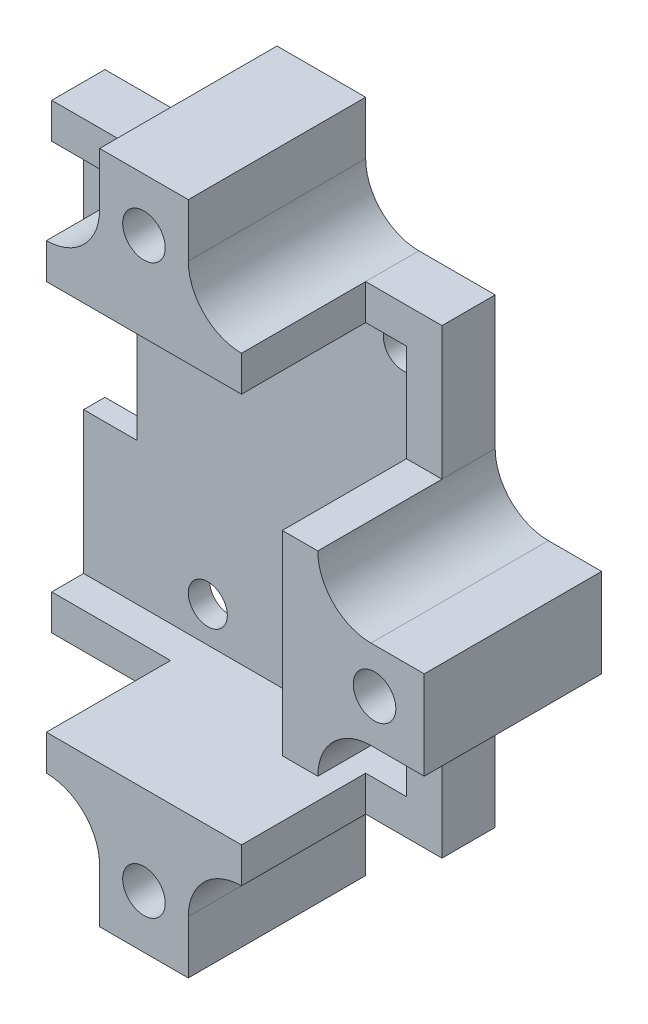
from build123d import *

# Parameters (mm, degrees)
SKETCH1_R           = 1.1
SKETCH1_W           = 5
SKETCH1_H           = 6
SKETCH1_R_2         = 1.2
SKETCH1_W_2         = 6
SKETCH1_H_2         = 5
BOSS_EXTRUDE1_DEPTH = 10
FILLET1_R           = 3
SKETCH2_W           = 28
SKETCH2_H           = 22
CUT_EXTRUDE1_DEPTH  = 8.8
SKETCH3_W           = 6.7
SKETCH3_H           = 26
SKETCH3_W_2         = 4.3
SKETCH3_H_2         = 7.5
CUT_EXTRUDE2_DEPTH  = 7


with BuildPart() as part:
    # Sketch1 → Boss-Extrude1 (new body)
    # profile 1 of 4: a face of its own
    with BuildSketch(Plane.XY):
        Polygon((0, 0), (22, 0), (22, -26), (0, -26), (0, -16), (3, -16), (3, -10), (0, -10), align=None)
        with Locations((18, -4)):
            Circle(SKETCH1_R, mode=Mode.SUBTRACT)
        with Locations((7, -4)):
            Circle(SKETCH1_R, mode=Mode.SUBTRACT)
        with Locations((7, -22)):
            Circle(SKETCH1_R, mode=Mode.SUBTRACT)
        with Locations((18, -22)):
            Circle(SKETCH1_R, mode=Mode.SUBTRACT)
    # profile 2 of 4: a face of its own
    with BuildSketch(Plane.XY):
        with Locations((12.2, 3)):
            Rectangle(SKETCH1_W, SKETCH1_H)
        with Locations((12.2, 3)):
            Circle(SKETCH1_R_2, mode=Mode.SUBTRACT)
    # profile 3 of 4: a face of its own
    with BuildSketch(Plane.XY):
        with Locations((25, -13)):
            Rectangle(SKETCH1_W_2, SKETCH1_H_2)
        with Locations((25.2, -13)):
            Circle(SKETCH1_R_2, mode=Mode.SUBTRACT)
    # profile 4 of 4: a face of its own
    with BuildSketch(Plane.XY):
        with Locations((12.2, -29)):
            Rectangle(SKETCH1_W, SKETCH1_H)
        with Locations((12.2, -29)):
            Circle(SKETCH1_R_2, mode=Mode.SUBTRACT)
    extrude(amount=BOSS_EXTRUDE1_DEPTH)

    # Fillet1
    fillet1_edges = [part.edges().sort_by_distance(p)[0] for p in [
        (9.7, 0, 5),
        (14.7, 0, 5),
        (22, -10.5, 5),
        (22, -15.5, 5),
        (14.7, -26, 5),
        (9.7, -26, 5),
    ]]
    fillet(fillet1_edges, radius=FILLET1_R)

    # Sketch2 → Cut-Extrude1 (cut)
    with BuildSketch(Plane.XY.offset(10)):
        with Locations((6, -13)):
            Rectangle(SKETCH2_W, SKETCH2_H)
    extrude(amount=-CUT_EXTRUDE1_DEPTH, mode=Mode.SUBTRACT)

    # Sketch3 → Cut-Extrude2 (cut)
    with BuildSketch(Plane.XY.offset(10)):
        with Locations((3.35, -13)):
            Rectangle(SKETCH3_W, SKETCH3_H)
        with Locations((19.85, -3.75)):
            Rectangle(SKETCH3_W_2, SKETCH3_H_2)
        with Locations((19.85, -22.25)):
            Rectangle(SKETCH3_W_2, SKETCH3_H_2)
    extrude(amount=-CUT_EXTRUDE2_DEPTH, mode=Mode.SUBTRACT)


solid = part.part
